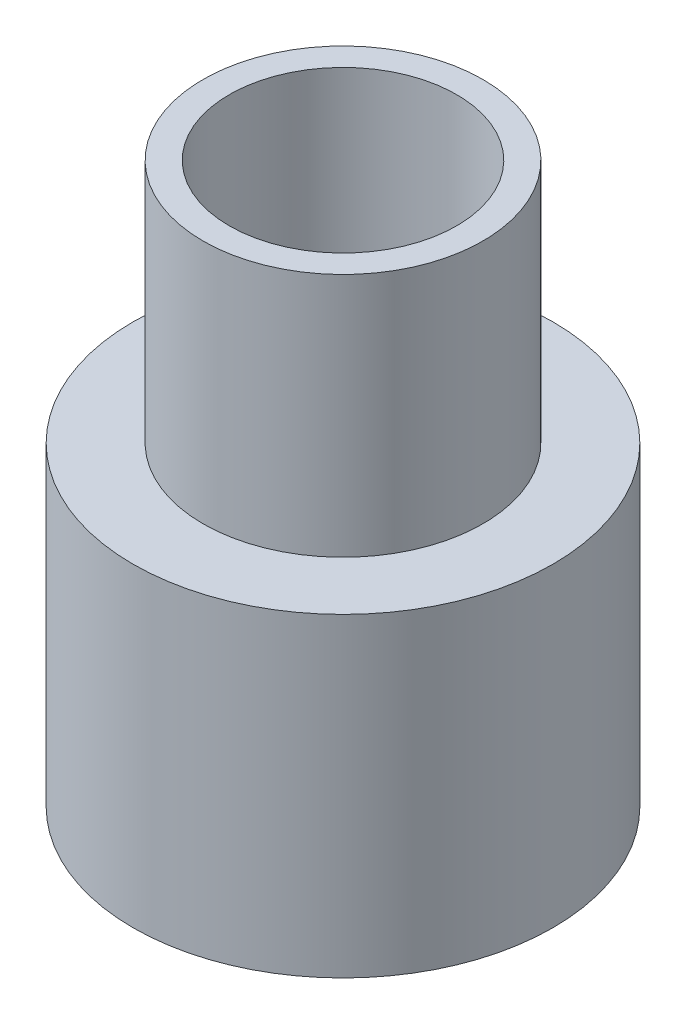
from build123d import *

# Parameters (mm, degrees)
CROQUIS1_R              = 6
CROQUIS1_R_2            = 3.25
SALIENTE_EXTRUIR1_DEPTH = 9
CROQUIS2_R              = 4
CROQUIS2_R_2            = 3.25
SALIENTE_EXTRUIR2_DEPTH = 7


with BuildPart() as part:
    # Croquis1 → Saliente-Extruir1 (new body)
    with BuildSketch(Plane(origin=(0, 0, 0), x_dir=(1, 0, 0), z_dir=(0, 1, 0))):
        with Locations(Location((0, 0, 0), (0, 0, 270))):
            Circle(CROQUIS1_R)
        with Locations(Location((0, 0, 0), (0, 0, 270))):
            Circle(CROQUIS1_R_2, mode=Mode.SUBTRACT)
    extrude(amount=SALIENTE_EXTRUIR1_DEPTH)

    # Croquis2 → Saliente-Extruir2 (add)
    with BuildSketch(Plane(origin=(0, 9, 0), x_dir=(1, 0, 0), z_dir=(0, 1, 0))):
        with Locations(Location((0, 0, 0), (0, 0, 270))):
            Circle(CROQUIS2_R)
        with Locations(Location((0, 0, 0), (0, 0, 270))):
            Circle(CROQUIS2_R_2, mode=Mode.SUBTRACT)
    extrude(amount=SALIENTE_EXTRUIR2_DEPTH)


solid = part.part
